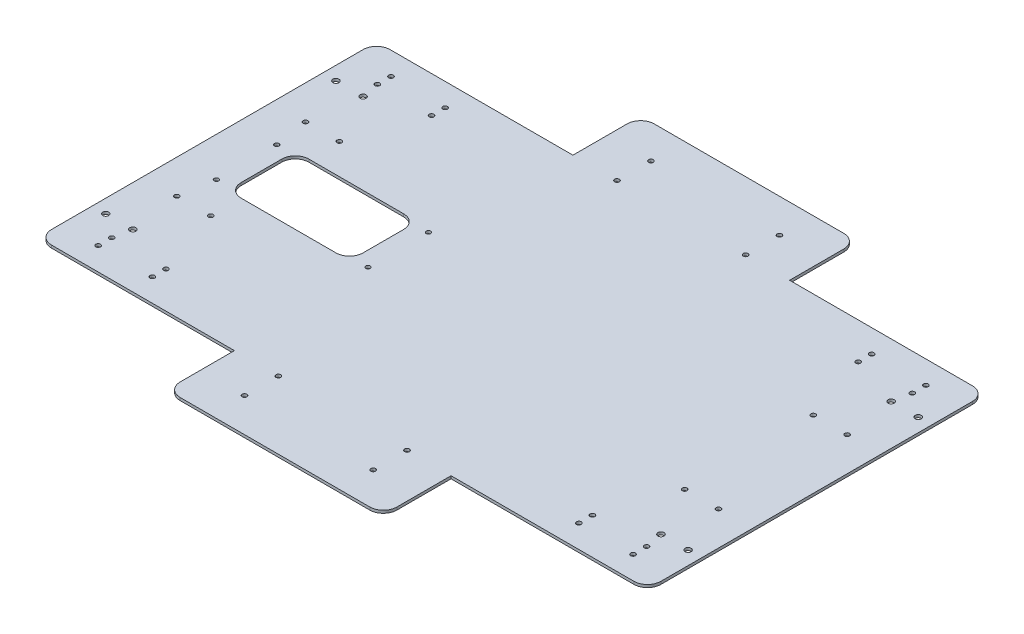
from build123d import *

# Parameters (mm, degrees)
SKETCH5_W            = 450
SKETCH5_H            = 350
BOSS_EXTRUDE1_DEPTH  = 2
FILLET1_R            = 10
CUT_EXTRUDE1_DEPTH   = 571.091220771
M4_CLEARANCE_HOLE1_D = 4.5
SKETCH13_R           = 1.75
CUT_EXTRUDE2_DEPTH   = 571.091220771
SKETCH14_R           = 1.75
CUT_EXTRUDE3_DEPTH   = 571.091220771
SKETCH15_W           = 145
SKETCH15_H           = 50
CUT_EXTRUDE4_DEPTH   = 571.091220771
FILLET2_R            = 10
SKETCH16_R           = 1.65
CUT_EXTRUDE5_DEPTH   = 571.091220771


with BuildPart() as part:
    # Sketch5 → Boss-Extrude1 (new body)
    with BuildSketch(Plane(origin=(0, 0, 0), x_dir=(1, 0, 0), z_dir=(0, 1, 0))):
        with Locations((225, 175)):
            Rectangle(SKETCH5_W, SKETCH5_H)
    extrude(amount=BOSS_EXTRUDE1_DEPTH)

    # Fillet1
    fillet1_edges = [part.edges().sort_by_distance(p)[0] for p in [
        (0, 1, 0),
        (0, 1, -350),
        (450, 1, -350),
        (450, 1, 0),
    ]]
    fillet(fillet1_edges, radius=FILLET1_R)

    # Sketch6 → Cut-Extrude1 (cut, through all)
    with BuildSketch(Plane(origin=(0, 2, 0), x_dir=(1, 0, 0), z_dir=(0, 1, 0))):
        with BuildLine():
            Line((130, 190), (130, 160))
            ThreePointArc((130, 160), (127.071067812, 152.928932188), (120, 150))
            Line((120, 150), (50, 150))
            ThreePointArc((50, 150), (42.928932188, 152.928932188), (40, 160))
            Line((40, 160), (40, 190))
            ThreePointArc((40, 190), (42.928932188, 197.071067812), (50, 200))
            Line((50, 200), (120, 200))
            ThreePointArc((120, 200), (127.071067812, 197.071067812), (130, 190))
        make_face()
    extrude(amount=-CUT_EXTRUDE1_DEPTH, mode=Mode.SUBTRACT)

    # M4 Clearance Hole1 (through all)
    with Locations(Plane(origin=(0, 2, 0), x_dir=(1, 0, 0), z_dir=(0, 1, 0))):
        with Locations((135, 10), (135, 30), (10, 90), (30, 90), (315, 10), (315, 30), (420, 90), (440, 90), (440, 260), (420, 260), (315, 340), (315, 320), (135, 340), (135, 320), (30, 260), (10, 260)):
            Hole(M4_CLEARANCE_HOLE1_D / 2)

    # Sketch13 → Cut-Extrude2 (cut, through all)
    with BuildSketch(Plane(origin=(0, 2, 0), x_dir=(1, 0, 0), z_dir=(0, 1, 0))):
        with Locations(Location((272.499999169, 49.973842701, 0), (0, 0, 90))):
            Circle(SKETCH13_R)
        with Locations(Location((272.499999169, 24.973842701, 0), (0, 0, 90))):
            Circle(SKETCH13_R)
        with Locations(Location((177.499999169, 49.973842701, 0), (0, 0, 90))):
            Circle(SKETCH13_R)
        with Locations(Location((177.499999169, 24.973842701, 0), (0, 0, 90))):
            Circle(SKETCH13_R)
        with Locations(Location((25, 222.5, 0), (0, 0, 270))):
            Circle(SKETCH13_R)
        with Locations(Location((50, 222.5, 0), (0, 0, 270))):
            Circle(SKETCH13_R)
        with Locations(Location((50, 127.5, 0), (0, 0, 270))):
            Circle(SKETCH13_R)
        with Locations(Location((25, 127.5, 0), (0, 0, 270))):
            Circle(SKETCH13_R)
        with Locations(Location((177.499999169, 325.026157299, 0), (0, 0, 270))):
            Circle(SKETCH13_R)
        with Locations(Location((272.499999169, 325.026157299, 0), (0, 0, 270))):
            Circle(SKETCH13_R)
        with Locations(Location((272.499999169, 300.026157299, 0), (0, 0, 270))):
            Circle(SKETCH13_R)
        with Locations(Location((177.499999169, 300.026157299, 0), (0, 0, 270))):
            Circle(SKETCH13_R)
        with Locations(Location((425, 127.5, 0), (0, 0, 90))):
            Circle(SKETCH13_R)
        with Locations(Location((400, 127.5, 0), (0, 0, 90))):
            Circle(SKETCH13_R)
        with Locations(Location((400, 222.5, 0), (0, 0, 90))):
            Circle(SKETCH13_R)
        with Locations(Location((425, 222.5, 0), (0, 0, 90))):
            Circle(SKETCH13_R)
    extrude(amount=-CUT_EXTRUDE2_DEPTH, mode=Mode.SUBTRACT)

    # Sketch14 → Cut-Extrude3 (cut, through all)
    with BuildSketch(Plane(origin=(0, 2, 0), x_dir=(1, 0, 0), z_dir=(0, 1, 0))):
        with Locations(Location((27.5, 76.9004, 0), (0, 0, 270))):
            Circle(SKETCH14_R)
        with Locations(Location((67.5, 76.9004, 0), (0, 0, 270))):
            Circle(SKETCH14_R)
        with Locations(Location((67.5, 66.9004, 0), (0, 0, 270))):
            Circle(SKETCH14_R)
        with Locations(Location((27.5, 66.9004, 0), (0, 0, 270))):
            Circle(SKETCH14_R)
        with Locations(Location((67.5, 283.0996, 0), (0, 0, 90))):
            Circle(SKETCH14_R)
        with Locations(Location((67.5, 273.0996, 0), (0, 0, 90))):
            Circle(SKETCH14_R)
        with Locations(Location((27.5, 283.0996, 0), (0, 0, 90))):
            Circle(SKETCH14_R)
        with Locations(Location((27.5, 273.0996, 0), (0, 0, 90))):
            Circle(SKETCH14_R)
        with Locations(Location((382.5, 273.0996, 0), (0, 0, 270))):
            Circle(SKETCH14_R)
        with Locations(Location((382.5, 283.0996, 0), (0, 0, 270))):
            Circle(SKETCH14_R)
        with Locations(Location((422.5, 283.0996, 0), (0, 0, 270))):
            Circle(SKETCH14_R)
        with Locations(Location((422.5, 273.0996, 0), (0, 0, 270))):
            Circle(SKETCH14_R)
        with Locations(Location((422.5, 66.9004, 0), (0, 0, 90))):
            Circle(SKETCH14_R)
        with Locations(Location((382.5, 66.9004, 0), (0, 0, 90))):
            Circle(SKETCH14_R)
        with Locations(Location((382.5, 76.9004, 0), (0, 0, 90))):
            Circle(SKETCH14_R)
        with Locations(Location((422.5, 76.9004, 0), (0, 0, 90))):
            Circle(SKETCH14_R)
    extrude(amount=-CUT_EXTRUDE3_DEPTH, mode=Mode.SUBTRACT)

    # Sketch15 → Cut-Extrude4 (cut, through all)
    with BuildSketch(Plane(origin=(0, 2, 0), x_dir=(1, 0, 0), z_dir=(0, 1, 0))):
        with Locations((72.5, 325)):
            Rectangle(SKETCH15_W, SKETCH15_H)
        with Locations((72.5, 25)):
            Rectangle(SKETCH15_W, SKETCH15_H)
        with Locations((377.5, 25)):
            Rectangle(SKETCH15_W, SKETCH15_H)
        with Locations((377.5, 325)):
            Rectangle(SKETCH15_W, SKETCH15_H)
    extrude(amount=-CUT_EXTRUDE4_DEPTH, mode=Mode.SUBTRACT)

    # Fillet2
    fillet2_edges = [part.edges().sort_by_distance(p)[0] for p in [
        (305, 1, -350),
        (450, 1, -300),
        (450, 1, -50),
        (305, 1, 0),
        (145, 1, 0),
        (0, 1, -50),
        (0, 1, -300),
        (145, 1, -350),
    ]]
    fillet(fillet2_edges, radius=FILLET2_R)

    # Sketch16 → Cut-Extrude5 (cut, through all)
    with BuildSketch(Plane(origin=(0, 2, 0), x_dir=(1, 0, 0), z_dir=(0, 1, 0))):
        with Locations(Location((29, 197.3, 0), (0, 0, 270))):
            Circle(SKETCH16_R)
        with Locations(Location((29, 152.7, 0), (0, 0, 270))):
            Circle(SKETCH16_R)
        with Locations(Location((141, 152.7, 0), (0, 0, 90))):
            Circle(SKETCH16_R)
        with Locations(Location((141, 197.3, 0), (0, 0, 90))):
            Circle(SKETCH16_R)
    extrude(amount=-CUT_EXTRUDE5_DEPTH, mode=Mode.SUBTRACT)


solid = part.part
